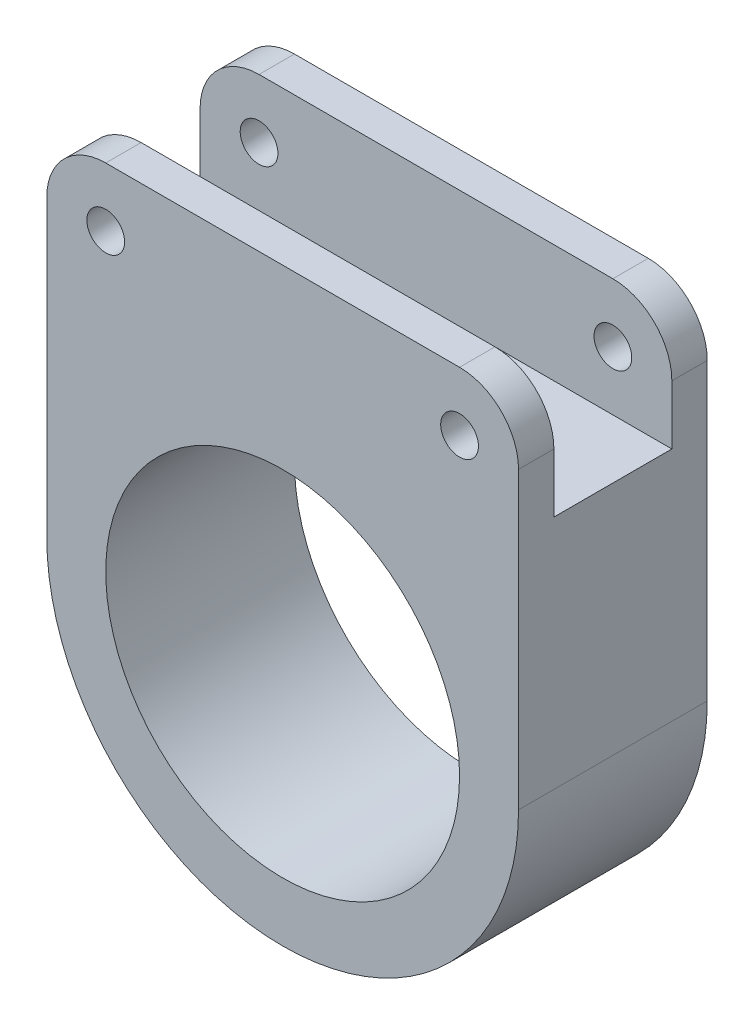
from build123d import *

# Parameters (mm, degrees)
SKETCH_1_R          = 15
SKETCH_1_R_2        = 1.6
EXTRUDE_1_DEPTH     = 16
SKETCH_2_W          = 40
SKETCH_2_H          = 10
CUT_EXTRUDE_1_DEPTH = 10
FILLET_2_R          = 5


with BuildPart() as part:
    # ｽｹｯﾁ1 → ﾎﾞｽ - 押し出し1 (new body)
    with BuildSketch(Plane.XY):
        with BuildLine():
            Line((20, 25), (-20, 25))
            Line((-20, 25), (-20, -5))
            ThreePointArc((-20, -5), (-14.142135624, -19.142135624), (0, -25))
            ThreePointArc((0, -25), (14.142135624, -19.142135624), (20, -5))
            Line((20, -5), (20, 25))
        make_face()
        with Locations((0, -5)):
            Circle(SKETCH_1_R, mode=Mode.SUBTRACT)
        with Locations((-15, 20)):
            Circle(SKETCH_1_R_2, mode=Mode.SUBTRACT)
        with Locations((15, 20)):
            Circle(SKETCH_1_R_2, mode=Mode.SUBTRACT)
    extrude(amount=EXTRUDE_1_DEPTH)

    # ｽｹｯﾁ2 → ｶｯﾄ - 押し出し1 (cut)
    with BuildSketch(Plane(origin=(0, 25, 0), x_dir=(1, 0, 0), z_dir=(0, 1, 0))):
        with Locations((0, -8)):
            Rectangle(SKETCH_2_W, SKETCH_2_H)
    extrude(amount=-CUT_EXTRUDE_1_DEPTH, mode=Mode.SUBTRACT)

    # ﾌｨﾚｯﾄ2
    fillet_2_edges = [part.edges().sort_by_distance(p)[0] for p in [
        (-20, 25, 14.5),
        (20, 25, 14.5),
        (-20, 25, 1.5),
        (20, 25, 1.5),
    ]]
    fillet(fillet_2_edges, radius=FILLET_2_R)


solid = part.part
